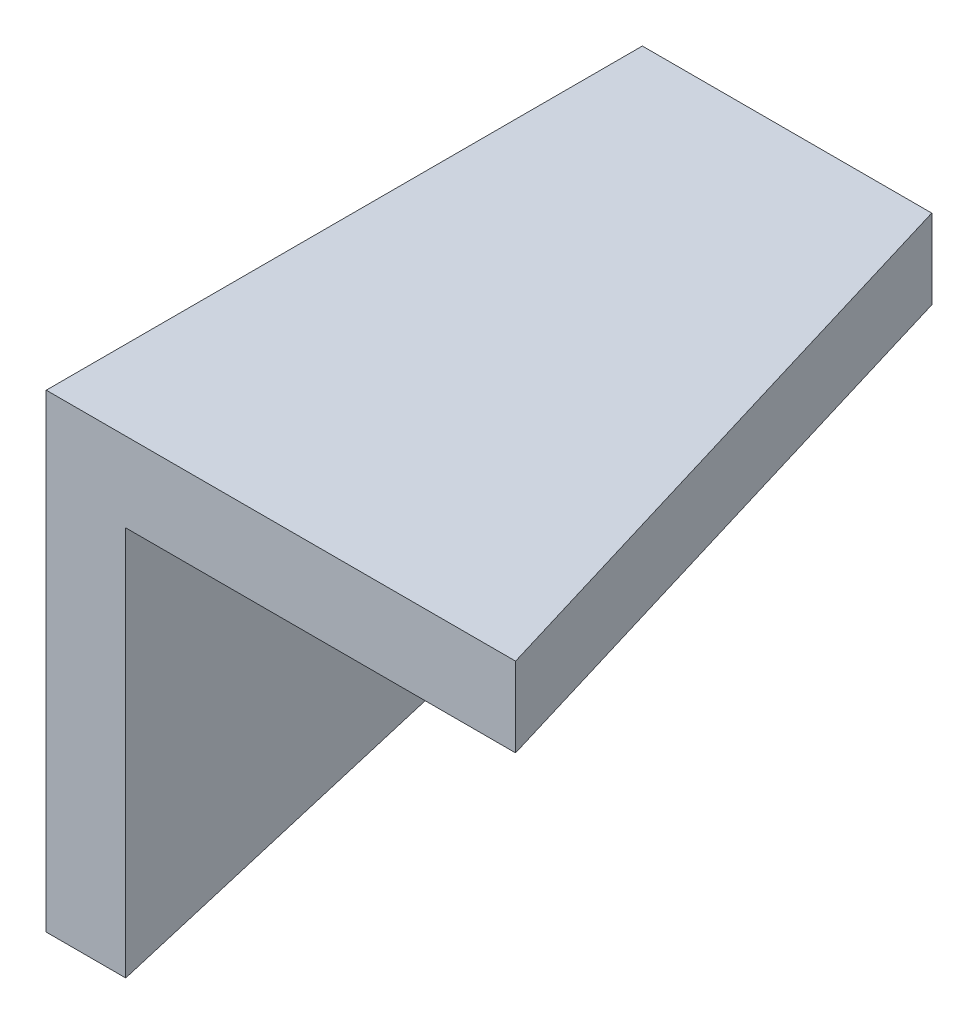
from build123d import *

# Parameters (mm, degrees)
BOSS_EXTRUDE1_DEPTH = 30
CUT_EXTRUDE1_DEPTH  = 10
CUT_EXTRUDE2_DEPTH  = 83.096264686


with BuildPart() as part:
    # Sketch1 → Boss-Extrude1 (new, symmetric)
    with BuildSketch(Plane.XY):
        Polygon((40, 0), (0, 0), (0, -40), (-8, -40), (-8, 8), (40, 8), align=None)
    extrude(amount=BOSS_EXTRUDE1_DEPTH, both=True)

    # Sketch2 → Cut-Extrude1 (cut)
    with BuildSketch(Plane.XZ):
        Polygon((39.240243059, 30), (21.129361647, -30), (40, -30), (40, 30), align=None)
    extrude(amount=-CUT_EXTRUDE1_DEPTH, mode=Mode.SUBTRACT)

    # Sketch4 → Cut-Extrude2 (cut, through all)
    with BuildSketch(Plane(origin=(0, 0, -30), x_dir=(-1, 0, 0), z_dir=(0, 0, -1))):
        Polygon((0, 0), (8, 8), (8, -40), (0, -40), align=None)
    extrude(amount=-CUT_EXTRUDE2_DEPTH, mode=Mode.SUBTRACT)

    # Mirror1: part across plane


with BuildPart() as part_1:
    add(part.part)
    add(part.part.mirror(Plane(origin=(0, 0, 30), x_dir=(0, 0, 1), z_dir=(0.7071067811865476, 0.7071067811865476, 0))))


solid = part_1.part
